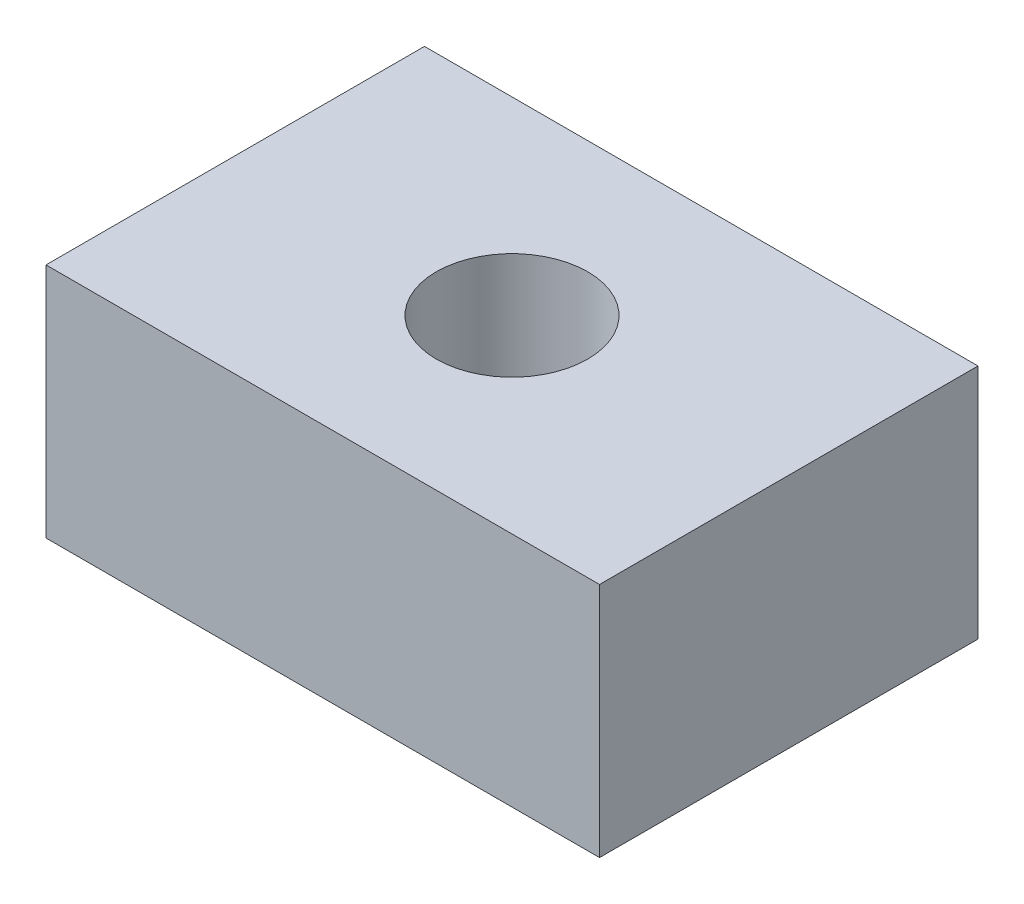
from build123d import *

# Parameters (mm, degrees)
SKETCH1_W           = 11.7
SKETCH1_H           = 8
BOSS_EXTRUDE1_DEPTH = 5
SKETCH2_R           = 1.6
CUT_EXTRUDE1_DEPTH  = 9.673090568


with BuildPart() as part:
    # Sketch1 → Boss-Extrude1 (new body)
    with BuildSketch(Plane(origin=(0, 0, 0), x_dir=(1, 0, 0), z_dir=(0, 1, 0))):
        Rectangle(SKETCH1_W, SKETCH1_H)
    extrude(amount=BOSS_EXTRUDE1_DEPTH)

    # Sketch2 → Cut-Extrude1 (cut, through all)
    with BuildSketch(Plane(origin=(0, 5, 0), x_dir=(1, 0, 0), z_dir=(0, 1, 0))):
        with Locations(Location((0, 0, 0), (0, 0, 270))):
            Circle(SKETCH2_R)
    extrude(amount=-CUT_EXTRUDE1_DEPTH, mode=Mode.SUBTRACT)


solid = part.part
